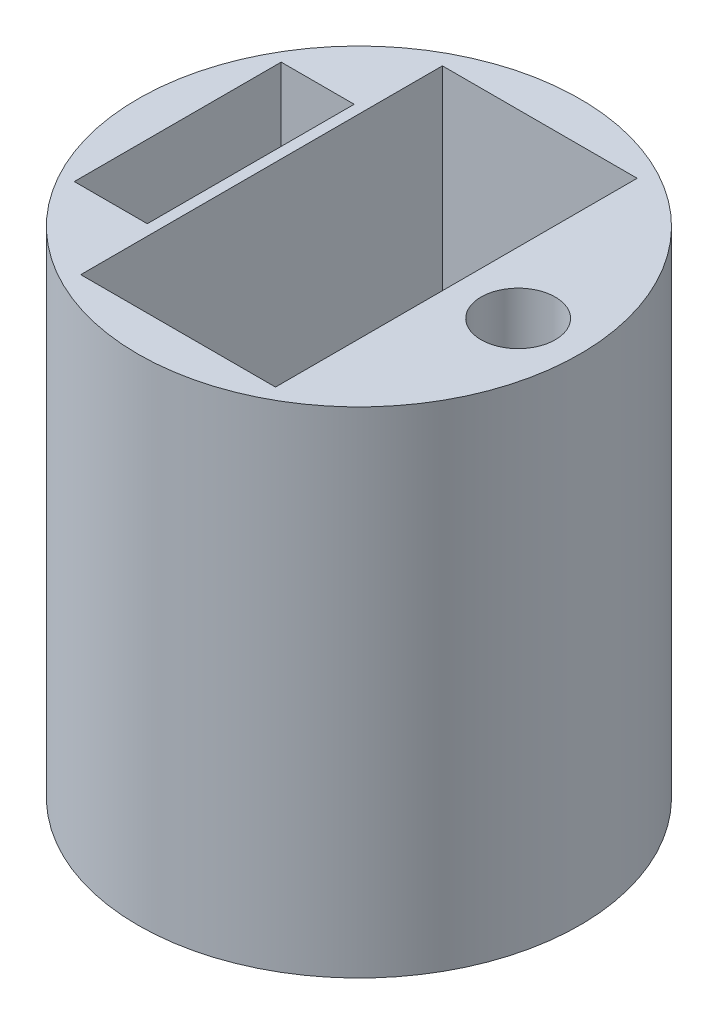
from build123d import *

# Parameters (mm, degrees)
SKETCH1_R           = 90.805
BOSS_EXTRUDE1_DEPTH = 203.2
SKETCH2_W           = 80.01
SKETCH2_H           = 148.59
CUT_EXTRUDE1_DEPTH  = 203.2
SKETCH3_W           = 30
SKETCH3_H           = 85
CUT_EXTRUDE2_DEPTH  = 130
SKETCH4_R           = 15.24
CUT_EXTRUDE3_DEPTH  = 203.2
SKETCH5_R           = 15.24
CUT_EXTRUDE4_DEPTH  = 63.5


with BuildPart() as part:
    # Sketch1 → Boss-Extrude1 (new body)
    with BuildSketch(Plane(origin=(0, 0, 0), x_dir=(1, 0, 0), z_dir=(0, 1, 0))):
        with Locations(Location((0, 0, 0), (0, 0, 270))):
            Circle(SKETCH1_R)
    extrude(amount=BOSS_EXTRUDE1_DEPTH)

    # Sketch2 → Cut-Extrude1 (cut)
    with BuildSketch(Plane(origin=(0, 203.2, 0), x_dir=(1, 0, 0), z_dir=(0, 1, 0))):
        Rectangle(SKETCH2_W, SKETCH2_H)
    extrude(amount=-CUT_EXTRUDE1_DEPTH, mode=Mode.SUBTRACT)

    # Sketch3 → Cut-Extrude2 (cut)
    with BuildSketch(Plane(origin=(0, 203.2, 0), x_dir=(1, 0, 0), z_dir=(0, 1, 0))):
        with Locations((-59.45, 0)):
            Rectangle(SKETCH3_W, SKETCH3_H)
    extrude(amount=-CUT_EXTRUDE2_DEPTH, mode=Mode.SUBTRACT)

    # Sketch4 → Cut-Extrude3 (cut)
    with BuildSketch(Plane(origin=(0, 203.2, 0), x_dir=(1, 0, 0), z_dir=(0, 1, 0))):
        with Locations(Location((65.405, 0, 0), (0, 0, 270))):
            Circle(SKETCH4_R)
    extrude(amount=-CUT_EXTRUDE3_DEPTH, mode=Mode.SUBTRACT)

    # Sketch5 → Cut-Extrude4 (cut)
    with BuildSketch(Plane(origin=(0, 0, 0), x_dir=(-1, 0, 0), z_dir=(0, -1, 0))):
        with Locations((53.34, -3.393876065)):
            Circle(SKETCH5_R)
    extrude(amount=-CUT_EXTRUDE4_DEPTH, mode=Mode.SUBTRACT)


solid = part.part
